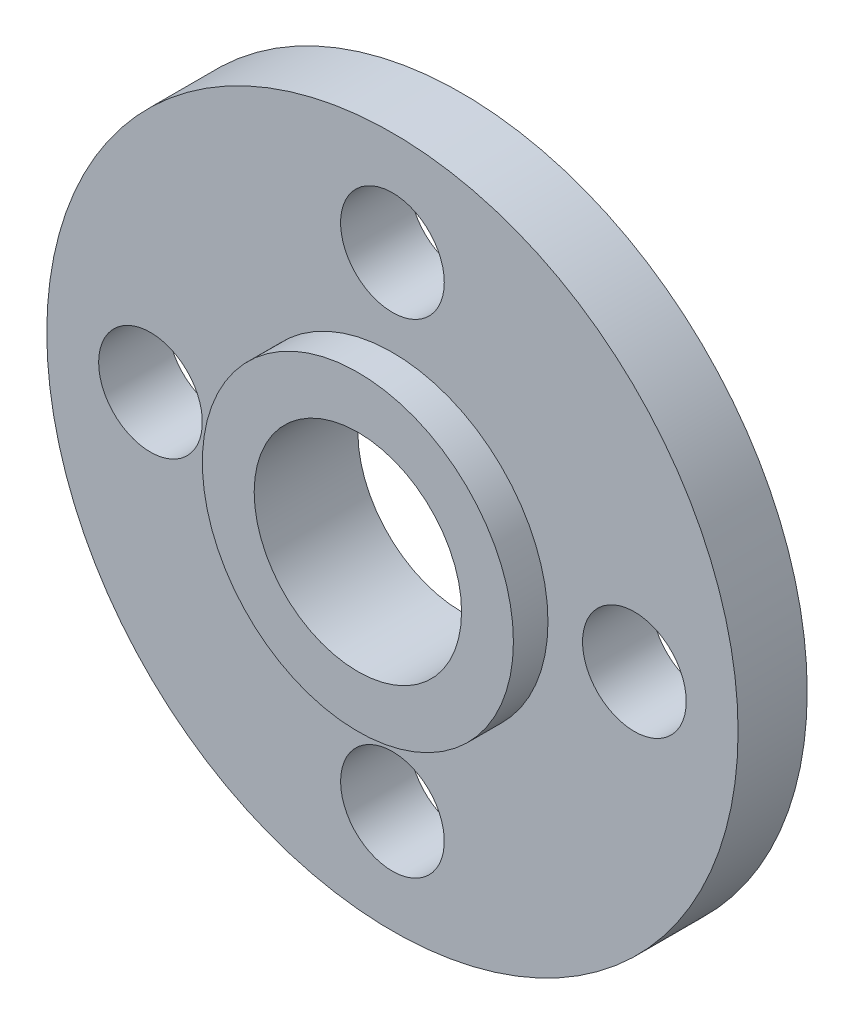
from build123d import *

# Parameters (mm, degrees)
SKETCH_1_R          = 10
EXTRUDE_1_DEPTH     = 2
SKETCH_2_R          = 1.5
CUT_EXTRUDE_1_DEPTH = 2
SKETCH_3_R          = 3
CUT_EXTRUDE_2_DEPTH = 2
EXTRUDE_START       = 1
SKETCH_4_R          = 4.5
SKETCH_4_R_2        = 3
EXTRUDE_4_DEPTH     = 1


with BuildPart() as part:
    # 草图1 → 凸台-拉伸1 (new body)
    with BuildSketch(Plane.XY):
        Circle(SKETCH_1_R)
    extrude(amount=EXTRUDE_1_DEPTH)

    # 草图2 → 切除-拉伸1 (cut)
    with BuildSketch(Plane.XY.offset(2)):
        with Locations((0, 7)):
            Circle(SKETCH_2_R)
        with Locations((7, 0)):
            Circle(SKETCH_2_R)
        with Locations(Location((0, -7, 0), (0, 0, 180))):
            Circle(SKETCH_2_R)
        with Locations(Location((-7, 0, 0), (0, 0, 180))):
            Circle(SKETCH_2_R)
    extrude(amount=-CUT_EXTRUDE_1_DEPTH, mode=Mode.SUBTRACT)

    # 草图3 → 切除-拉伸2 (cut)
    with BuildSketch(Plane.XY.offset(2)):
        Circle(SKETCH_3_R)
    extrude(amount=-CUT_EXTRUDE_2_DEPTH, mode=Mode.SUBTRACT)

    # 草图4 → 凸台-拉伸4 (add)
    with BuildSketch(Plane.XY.offset(2).offset(EXTRUDE_START)):
        Circle(SKETCH_4_R)
        Circle(SKETCH_4_R_2, mode=Mode.SUBTRACT)
    extrude(amount=-EXTRUDE_4_DEPTH)


solid = part.part
